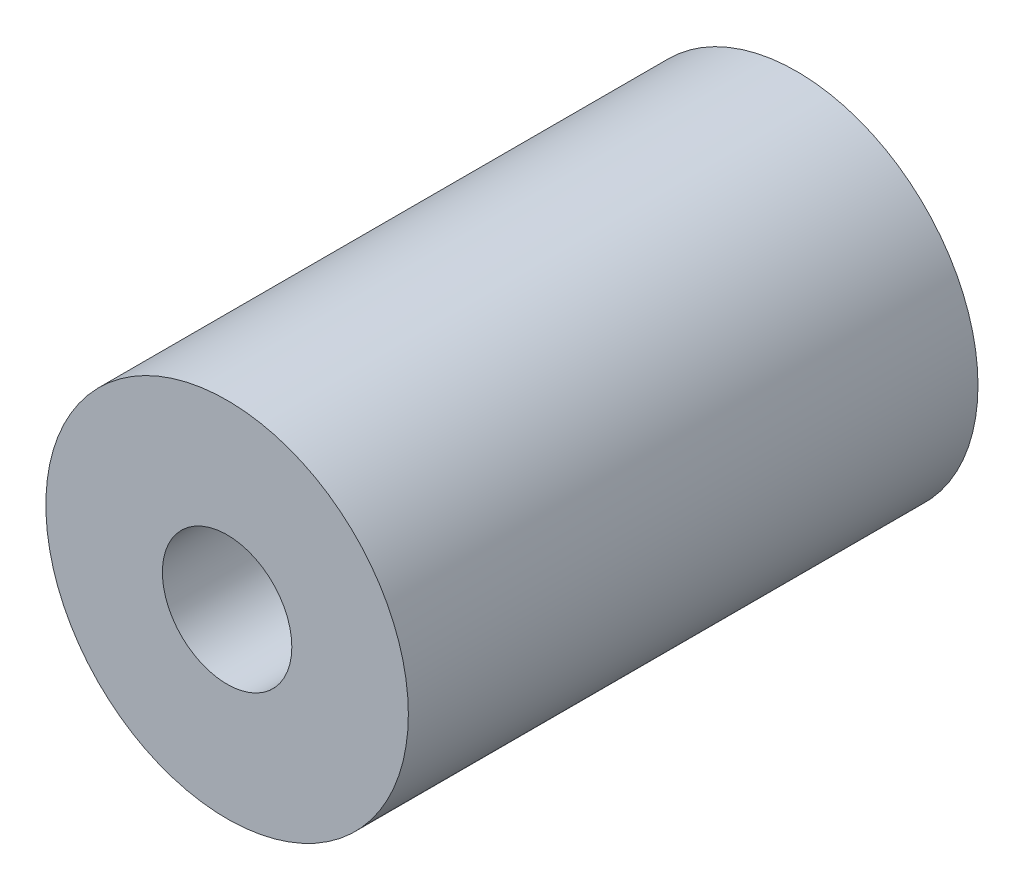
from build123d import *

# Parameters (mm, degrees)
SKETCH1_R           = 7
BOSS_EXTRUDE1_DEPTH = 11
SKETCH2_R           = 2.5
CUT_EXTRUDE1_DEPTH  = 6.5
SKETCH3_R           = 4
CUT_EXTRUDE2_DEPTH  = 6.5


with BuildPart() as part:
    # Sketch1 → Boss-Extrude1 (new, symmetric)
    with BuildSketch(Plane.XY):
        Circle(SKETCH1_R)
    extrude(amount=BOSS_EXTRUDE1_DEPTH, both=True)

    # Sketch2 → Cut-Extrude1 (cut)
    with BuildSketch(Plane.XY.offset(11)):
        Circle(SKETCH2_R)
    extrude(amount=-CUT_EXTRUDE1_DEPTH, mode=Mode.SUBTRACT)

    # Sketch3 → Cut-Extrude2 (cut)
    with BuildSketch(Plane(origin=(0, 0, -11), x_dir=(-1, 0, 0), z_dir=(0, 0, -1))):
        Circle(SKETCH3_R)
    extrude(amount=-CUT_EXTRUDE2_DEPTH, mode=Mode.SUBTRACT)


solid = part.part
